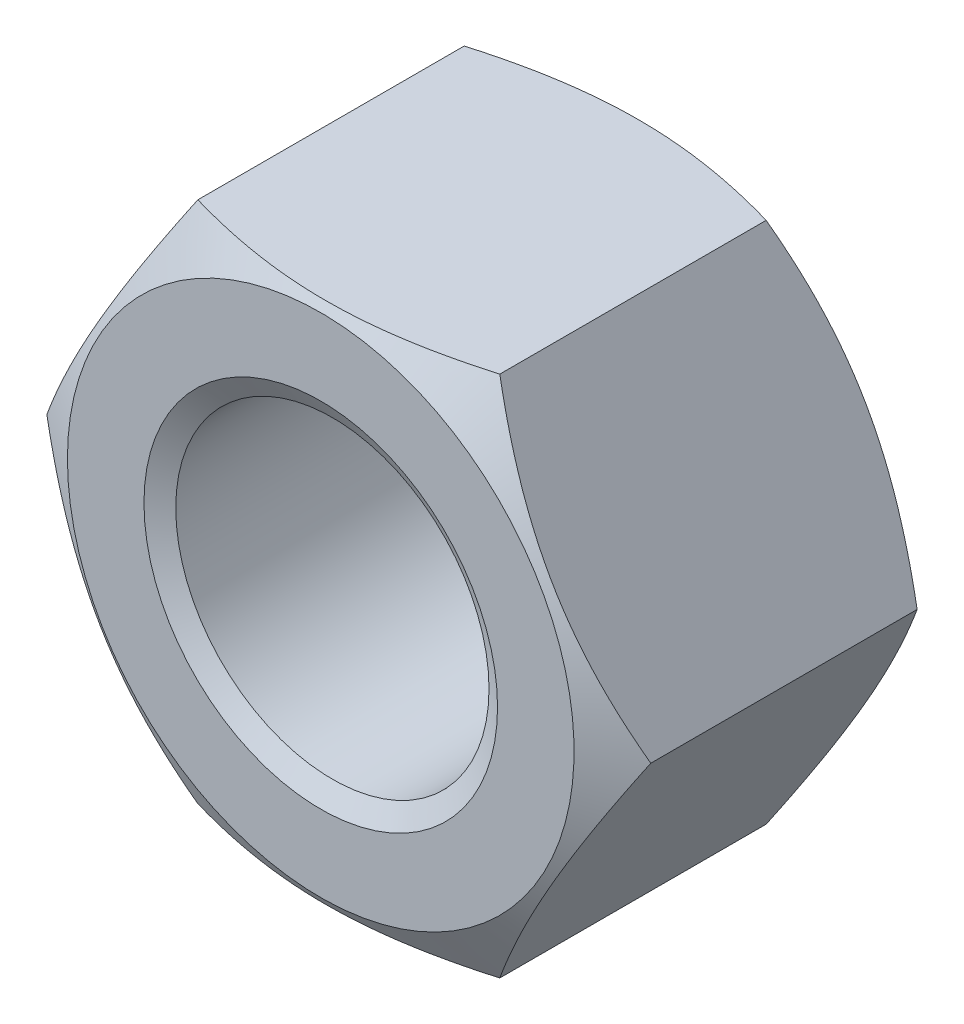
from build123d import *
from OCP.BRepFilletAPI import BRepFilletAPI_MakeChamfer

# Parameters (mm, degrees)
SKETCH1_R        = 7.188
BASENUT_DEPTH    = 14.8
ENDCHAMFER_SIZE  = 0.925
ENDCHAMFER_SIZE2 = 0.534048999


with BuildPart() as part:
    # Sketch1 → BaseNut (new body)
    with BuildSketch(Plane.XY):
        Polygon((6.92820323, -12), (13.856406461, 0), (6.92820323, 12), (-6.92820323, 12), (-13.856406461, 0), (-6.92820323, -12), align=None)
        Circle(SKETCH1_R, mode=Mode.SUBTRACT)
    extrude(amount=-BASENUT_DEPTH)

    # Sketch2 → Double-Chamfer (revolve, cut)
    with BuildSketch(Plane(origin=(0, 0, 0), x_dir=(1, 0, 0), z_dir=(0, 1, 0))):
        Polygon((-13.856406461, 14.8), (-11.625, 14.8), (-13.856406461, 13.511696879), align=None)
        Polygon((-13.856406461, 1.288303121), (-13.856406461, 0), (-11.625, 0), align=None)
    revolve(axis=Axis((0, 0, -9.817107763), (0, 0, 1)), mode=Mode.SUBTRACT)

    # EndChamfer: one chamfer whose edges measure the first distance from different faces: ONE call of the kernel's chamfer builder (chamfer() names one face for all edges)
    endchamfer_edges_1 = [part.edges().sort_by_distance(p)[0] for p in [
        (-7.188, 0, -14.8),
    ]]
    endchamfer_side_1 = [part.faces().sort_by_distance(p)[0] for p in [
        (-7.188, 0, -7.4),
    ]]
    endchamfer_edges_2 = [part.edges().sort_by_distance(p)[0] for p in [
        (-7.188, 0, 0),
    ]]
    endchamfer_side_2 = [part.faces().sort_by_distance(p)[0] for p in [
        (11.296195347, 0, 0),
    ]]
    endchamfer = BRepFilletAPI_MakeChamfer(part.part.solid().wrapped)
    for e in endchamfer_edges_1:
        endchamfer.Add(ENDCHAMFER_SIZE, ENDCHAMFER_SIZE2, e.wrapped, endchamfer_side_1[0].wrapped)  # the first distance lies on this face
    for e in endchamfer_edges_2:
        endchamfer.Add(ENDCHAMFER_SIZE, ENDCHAMFER_SIZE2, e.wrapped, endchamfer_side_2[0].wrapped)  # the first distance lies on this face
    add(Compound.cast(endchamfer.Shape()), mode=Mode.REPLACE)


solid = part.part
